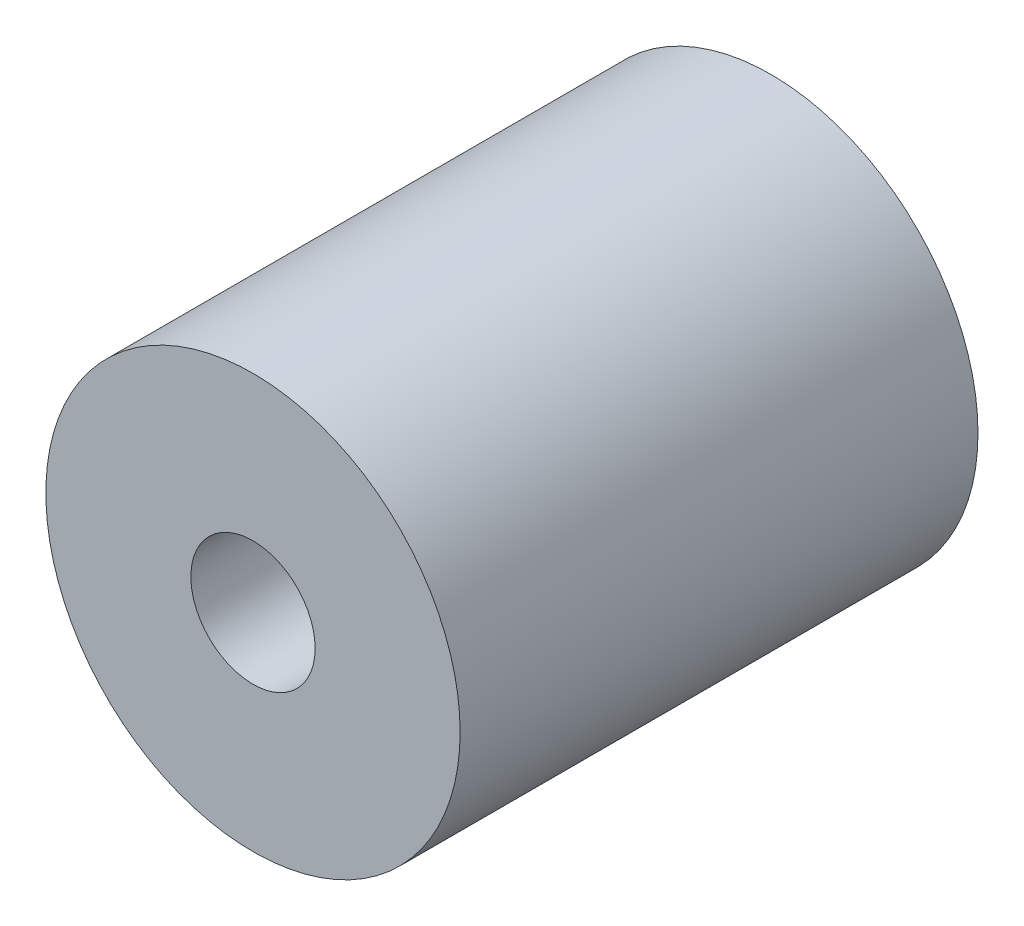
from build123d import *

# Parameters (mm, degrees)
BOSS_EXTRUDE1_DEPTH      = 7.5
BOSS_EXTRUDE1_DEPTH_BACK = 7.5
SKETCH1_R                = 10
BOSS_EXTRUDE2_DEPTH      = 12.5
BOSS_EXTRUDE2_DEPTH_BACK = 12.5
SKETCH1_2_R              = 10
SKETCH1_2_R_2            = 3


with BuildPart() as part:
    # Sketch1 → Boss-Extrude1 (new, two sides: drawn at the far end of the back side and taken through both)
    with BuildSketch(Plane.XY.offset(-BOSS_EXTRUDE1_DEPTH_BACK)):
        Circle(SKETCH1_R)
    extrude(amount=BOSS_EXTRUDE1_DEPTH + BOSS_EXTRUDE1_DEPTH_BACK)

    # Sketch1<2> → Boss-Extrude2 (add, two sides: drawn at the far end of the back side and taken through both)
    with BuildSketch(Plane.XY.offset(-BOSS_EXTRUDE2_DEPTH_BACK)):
        Circle(SKETCH1_2_R)
        Circle(SKETCH1_2_R_2, mode=Mode.SUBTRACT)
    extrude(amount=BOSS_EXTRUDE2_DEPTH + BOSS_EXTRUDE2_DEPTH_BACK)


solid = part.part
